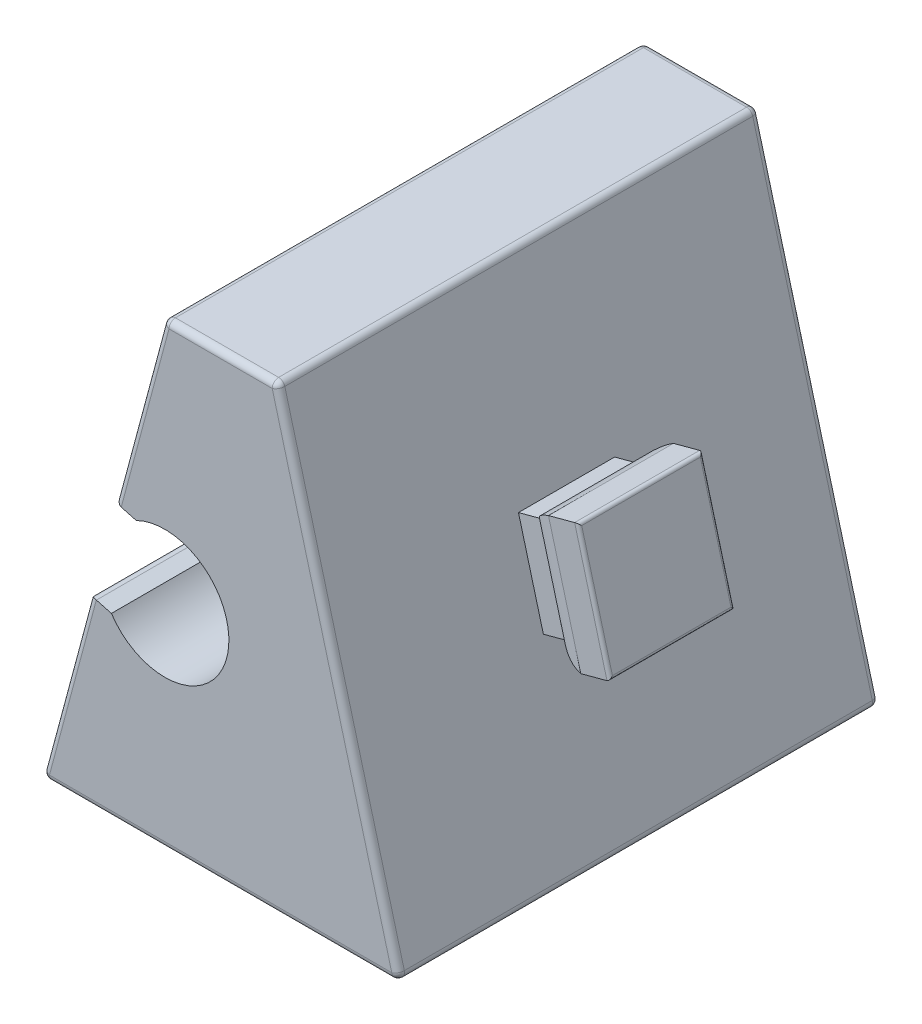
from build123d import *

# Parameters (mm, degrees)
EXTRUDE_1_DEPTH           = 15
CUT_EXTRUDE_1_DEPTH       = 15
SKETCH_5_W                = 3
SKETCH_5_H                = 3
EXTRUDE_2_DEPTH           = 0.68
EXTRUDE_3_DEPTH           = 5
EXTRUDE_3_DEPTH_BACK      = 5
CUT_EXTRUDE_11_DEPTH      = 5
CUT_EXTRUDE_11_DEPTH_BACK = 5
FILLET_1_R                = 0.2
FILLET_5_R                = 0.1


with BuildPart() as part:
    # 草图1 → 凸台-拉伸1 (new body)
    with BuildSketch(Plane.XY):
        Polygon((-5.6, 0), (5.6, 0), (1.762967564, 14.32), (-1.762967564, 14.32), align=None)
    extrude(amount=EXTRUDE_1_DEPTH)

    # 草图2 → 切除-拉伸1 (cut)
    with BuildSketch(Plane.XY.offset(15)):
        with BuildLine():
            Line((-3.681483782, 7.16), (-4.06971235, 5.711111261))
            Line((-4.06971235, 5.711111261), (-3.407492768, 5.533670058))
            ThreePointArc((-3.407492768, 5.533670058), (0.190360002, 6.122701516), (-2.631169509, 8.431483409))
            Line((-2.631169509, 8.431483409), (-3.293255215, 8.608888739))
            Line((-3.293255215, 8.608888739), (-3.681483782, 7.16))
        make_face()
    extrude(amount=-CUT_EXTRUDE_1_DEPTH, mode=Mode.SUBTRACT)

    # 草图5 → 凸台-拉伸2 (add)
    with BuildSketch(Plane(origin=(5.224871131, 1.4, 0), x_dir=(0, 0, -1), z_dir=(0.9659258262890671, 0.2588190451025256, 0))):
        with Locations((-7.5, 5.963190799)):
            Rectangle(SKETCH_5_W, SKETCH_5_H)
    extrude(amount=EXTRUDE_2_DEPTH)

    # 草图6 → 凸台-拉伸3 (add, two sides: drawn at the far end of the back side and taken through both)
    with BuildSketch(Plane(origin=(-1.155158781, 4.311111261, 0), x_dir=(0.965925826289067, 0.2588190451025257, 0), z_dir=(0.2588190451025257, -0.965925826289067, 0)).offset(-EXTRUDE_3_DEPTH_BACK)):
        with BuildLine():
            Line((7.909184627, 5.55), (6.964774906, 5.55))
            ThreePointArc((6.964774906, 5.55), (6.497346154, 5.719957697), (6.086308972, 6))
            Line((6.086308972, 6), (6.086308972, 9))
            ThreePointArc((6.086308972, 9), (6.497346154, 9.280042303), (6.964774906, 9.45))
            Line((6.964774906, 9.45), (7.909184627, 9.45))
            Line((7.909184627, 9.45), (7.909184627, 5.55))
        make_face()
    extrude(amount=EXTRUDE_3_DEPTH + EXTRUDE_3_DEPTH_BACK)

    # 草图7 → 切除-拉伸11 (cut, two sides: drawn at the far end of the back side and taken through both)
    with BuildSketch(Plane.XY.offset(9).offset(-CUT_EXTRUDE_11_DEPTH_BACK)):
        with BuildLine():
            Line((5.59160121, 9.690602974), (4.67937147, 9.446171752))
            ThreePointArc((4.67937147, 9.446171752), (4.271858255, 9.16102576), (3.947307106, 8.784141416))
            Line((3.947307106, 8.784141416), (3.429669016, 10.715993068))
            Line((3.429669016, 10.715993068), (4.27820195, 10.943356783))
            Line((4.27820195, 10.943356783), (5.19043169, 11.187788005))
            Line((5.19043169, 11.187788005), (5.59160121, 9.690602974))
        make_face()
        with BuildLine():
            Line((6.600995486, 5.923492251), (5.688765746, 5.679061029))
            ThreePointArc((5.688765746, 5.679061029), (5.193275954, 5.722248095), (4.723764242, 5.886363937))
            Line((4.723764242, 5.886363937), (6.017859467, 1.056734805))
            Line((6.017859467, 1.056734805), (6.866392401, 1.28409852))
            Line((6.866392401, 1.28409852), (7.778622141, 1.528529742))
            Line((7.778622141, 1.528529742), (6.600995486, 5.923492251))
        make_face()
    extrude(amount=CUT_EXTRUDE_11_DEPTH + CUT_EXTRUDE_11_DEPTH_BACK, mode=Mode.SUBTRACT)

    # 圆角1
    fillet_1_edges = [part.edges().sort_by_distance(p)[0] for p in [
        (0, 0, 15),
        (3.681483782, 7.16, 15),
        (-4.834856175, 2.85555563, 0),
        (-4.834856175, 2.85555563, 15),
        (-3.293255215, 8.608888739, 7.5),
        (-4.06971235, 5.711111261, 7.5),
        (0, 14.32, 15),
        (3.681483782, 7.16, 0),
        (0, 0, 0),
        (-2.528111389, 11.46444437, 0),
        (0, 14.32, 0),
        (-2.528111389, 11.46444437, 15),
        (1.762967564, 14.32, 7.5),
        (5.6, 0, 7.5),
        (-5.6, 0, 7.5),
        (-1.762967564, 14.32, 7.5),
    ]]
    fillet(fillet_1_edges, radius=FILLET_1_R)

    # 圆角5
    fillet_5_edges = [part.edges().sort_by_distance(p)[0] for p in [
        (6.096298348, 7.807047613, 9.45),
        (6.096298348, 7.807047613, 5.55),
        (5.59160121, 9.690602974, 7.5),
        (6.600995486, 5.923492251, 7.5),
    ]]
    fillet(fillet_5_edges, radius=FILLET_5_R)


solid = part.part
